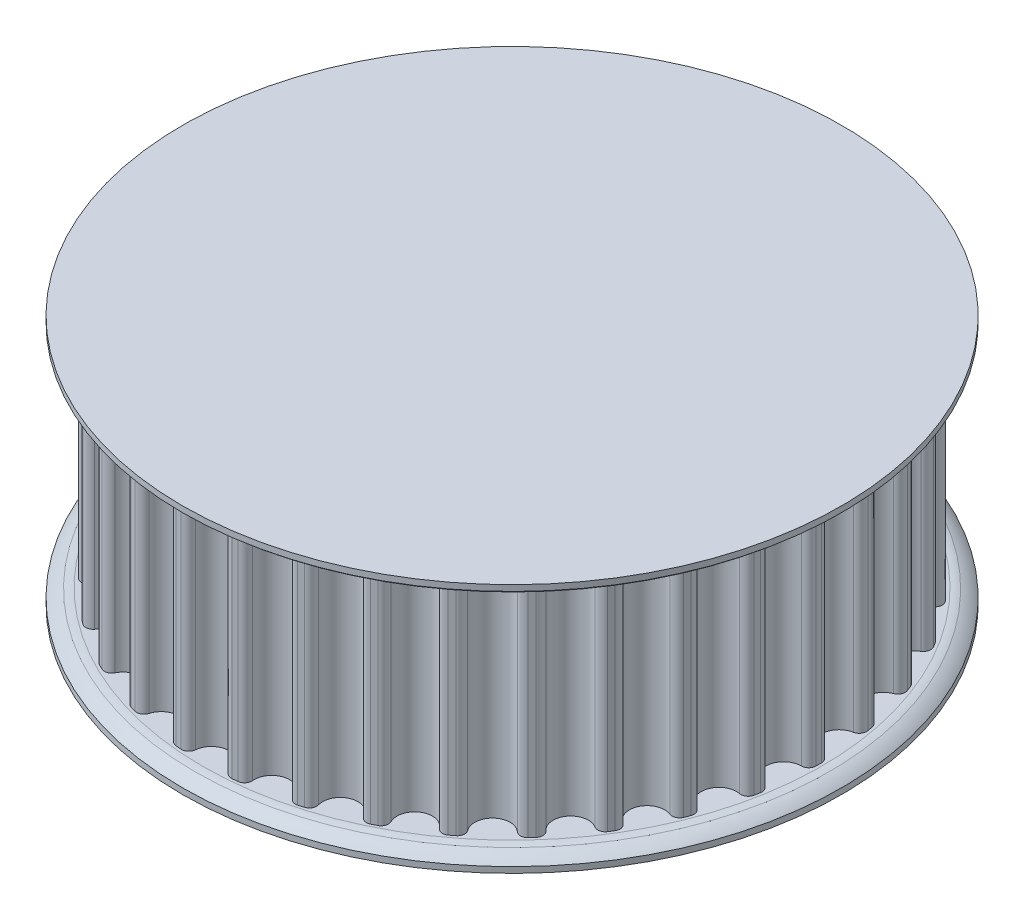
from build123d import *

# Parameters (mm, degrees)
SKETCH1_R               = 26.484839817
TOOTHOD_DEPTH           = 9.525
TOOTHPROFILE_DEPTH      = 43.021375278
TOOTHPATTERN_COUNT      = 34
LARGE_TOOTH_COUNT_DEPTH = 0.4


with BuildPart() as part:
    # Sketch1 → ToothOD (new, symmetric)
    with BuildSketch(Plane(origin=(0, 0, 0), x_dir=(1, 0, 0), z_dir=(0, 1, 0))):
        Circle(SKETCH1_R)
    extrude(amount=TOOTHOD_DEPTH, both=True)

    # Sketch2 → ToothProfile (cut, through all)
    with BuildSketch(Plane(origin=(0, 9.525, 0), x_dir=(1, 0, 0), z_dir=(0, 1, 0))):
        with BuildLine():
            ThreePointArc((-1.519107163, 25.8159054), (0, 24.424839817), (1.519107163, 25.8159054))
            ThreePointArc((1.519107163, 25.8159054), (1.742690761, 26.245908095), (2.204508681, 26.392932418))
            ThreePointArc((2.204508681, 26.392932418), (0, 26.484839817), (-2.204508681, 26.392932418))
            ThreePointArc((-2.204508681, 26.392932418), (-1.742690761, 26.245908095), (-1.519107163, 25.8159054))
        make_face()
    toothprofile = extrude(amount=-TOOTHPROFILE_DEPTH, mode=Mode.SUBTRACT)

    # ToothPattern: ToothProfile ×34 about axis
    toothpattern_axis = Axis((0, 9.525, 0), (0, -1, 0))
    for i in range(1, TOOTHPATTERN_COUNT):
        add(toothprofile.rotate(toothpattern_axis, i * 360 / TOOTHPATTERN_COUNT), mode=Mode.SUBTRACT)

    # Sketch4 → Flange (revolve)
    with BuildSketch(Plane.XY):
        with BuildLine():
            Line((0, -9.525), (26.738839817, -9.525))
            ThreePointArc((26.738839817, -9.525), (27.064595807, -9.550622571), (27.384412145, -9.617637424))
            ThreePointArc((27.384412145, -9.617637424), (27.952140722, -9.899197125), (28.453339817, -10.287))
            Line((28.453339817, -10.287), (28.453339817, -10.795))
            Line((28.453339817, -10.795), (0, -10.795))
            Line((0, -10.795), (0, -9.525))
        make_face()
        with BuildLine():
            Line((28.453339817, 10.795), (28.453339817, 10.287))
            ThreePointArc((28.453339817, 10.287), (27.952140722, 9.899197125), (27.384412145, 9.617637424))
            ThreePointArc((27.384412145, 9.617637424), (27.064595807, 9.550622571), (26.738839817, 9.525))
            Line((26.738839817, 9.525), (0, 9.525))
            Line((0, 9.525), (0, 10.795))
            Line((0, 10.795), (28.453339817, 10.795))
        make_face()
    revolve(axis=Axis((0, 12.09802, 0), (0, -1, 0)))

    # Sketch9 → Large Tooth Count (cut)
    # profile 1 of 2: a face of its own
    with BuildSketch(Plane(origin=(0, -10.795, 0), x_dir=(1, 0, 0), z_dir=(0, 1, 0))):
        with BuildLine():
            add(Edge.make_bspline(
                [(-2.989174355, 21.422297126), (-2.937372338, 21.431036898), (-2.836884144, 21.447990755), (-2.695079725, 21.495551039), (-2.568839312, 21.561735922), (-2.475077085, 21.629093694), (-2.410898341, 21.691418062), (-2.37068168, 21.74166973), (-2.337184735, 21.794442084), (-2.311650786, 21.850576253), (-2.295032481, 21.909964159), (-2.284910755, 21.971962869), (-2.283268817, 22.036807513), (-2.287710531, 22.080444809), (-2.289979824, 22.102739313)],
                knots=[0, 0, 0, 0, 1.729524362, 3.355019587, 4.903849319, 6.41264726, 7.141005846, 7.845728411, 8.528887919, 9.196229096, 9.869956459, 10.555365984, 11.261929537, 12, 12, 12, 12], degree=3))
            add(Edge.make_bspline(
                [(-2.289979824, 22.102739313), (-2.296734057, 22.135991764), (-2.310062135, 22.201608588), (-2.358350173, 22.292233629), (-2.42809507, 22.371735092), (-2.517774062, 22.440093399), (-2.624849435, 22.494177587), (-2.748288868, 22.52558726), (-2.885080706, 22.537746509), (-2.979696266, 22.527705131), (-3.029357949, 22.522434626)],
                knots=[0, 0, 0, 0, 0.857195332, 1.69149742, 2.56959501, 3.522717451, 4.535906977, 5.591035759, 6.735586199, 8, 8, 8, 8], degree=3))
            add(Edge.make_bspline(
                [(-3.029357949, 22.522434626), (-3.060397966, 22.51784344), (-3.119300841, 22.509131006), (-3.202061719, 22.489469195), (-3.27463794, 22.465469616), (-3.337923807, 22.437933612), (-3.392445424, 22.406011145), (-3.440184301, 22.371152265), (-3.4817063, 22.332592058), (-3.517326455, 22.289404099), (-3.549176296, 22.240204344), (-3.580466656, 22.183940922), (-3.610507558, 22.118312972), (-3.649628121, 22.021446908), (-3.695100521, 21.899319393), (-3.730956812, 21.80211419), (-3.748197793, 21.75537447)],
                knots=[0, 0, 0, 0, 1.15701711, 2.195605557, 3.133047247, 3.973602682, 4.736259503, 5.458737205, 6.150093777, 6.820649565, 7.517995778, 8.309278116, 9.193447536, 10.178237295, 12.16236053, 14, 14, 14, 14], degree=3))
            add(Edge.make_bspline(
                [(-3.748197793, 21.75537447), (-3.755206069, 21.744024378), (-3.770538374, 21.719193301), (-3.805735367, 21.686538361), (-3.852154196, 21.655474027), (-3.928992268, 21.615510776), (-4.038920322, 21.572206557), (-4.13352996, 21.555766592), (-4.182180605, 21.547312751)],
                knots=[0, 0, 0, 0, 0.483691287, 1.058191976, 1.728197171, 2.51319426, 4.206997195, 6, 6, 6, 6], degree=3))
            add(Edge.make_bspline(
                [(-4.182180605, 21.547312751), (-4.210162503, 21.544732885), (-4.266018725, 21.539583073), (-4.3501373, 21.551484302), (-4.432416225, 21.576858579), (-4.510866733, 21.615653104), (-4.582569522, 21.666895651), (-4.636670609, 21.735524068), (-4.677201812, 21.814904446), (-4.688178486, 21.873971753), (-4.693851699, 21.904500251)],
                knots=[0, 0, 0, 0, 0.969039054, 1.934352708, 2.91448301, 3.936533358, 4.951560652, 5.932285448, 6.931317116, 8, 8, 8, 8], degree=3))
            add(Edge.make_bspline(
                [(-4.693851699, 21.904500251), (-4.695987549, 21.934266309), (-4.700357634, 21.99516956), (-4.688750471, 22.089402279), (-4.66098975, 22.186033585), (-4.619595318, 22.2856395), (-4.563377151, 22.386074075), (-4.491665408, 22.485719437), (-4.406452836, 22.584495662), (-4.308399263, 22.683311923), (-4.194612543, 22.777430517), (-4.066983859, 22.867491229), (-3.922682053, 22.947724341), (-3.766183459, 23.024105), (-3.59569268, 23.090671898), (-3.413369985, 23.146791523), (-3.219935353, 23.191623402), (-3.086665382, 23.212080504), (-3.018642324, 23.222522126)],
                knots=[0, 0, 0, 0, 0.616992876, 1.262406708, 1.953436793, 2.694186468, 3.491785785, 4.331720199, 5.232443181, 6.191491911, 7.211328802, 8.287098999, 9.421877506, 10.6268312, 11.891873317, 13.20814025, 14.574991515, 16, 16, 16, 16], degree=3))
            add(Edge.make_bspline(
                [(-3.018642324, 23.222522126), (-2.956502574, 23.229868403), (-2.834279655, 23.244317823), (-2.652885578, 23.251968677), (-2.477176266, 23.24879706), (-2.307752159, 23.233447531), (-2.14520404, 23.208240214), (-1.991428111, 23.170687628), (-1.846751613, 23.122484059), (-1.712402451, 23.063667397), (-1.588772518, 22.996636653), (-1.47954172, 22.919415754), (-1.383583108, 22.835296255), (-1.30291333, 22.742833554), (-1.236548042, 22.644277623), (-1.184348845, 22.541222862), (-1.146429345, 22.433417051), (-1.133726374, 22.358974532), (-1.127334512, 22.321516657)],
                knots=[0, 0, 0, 0, 1.29520736, 2.547548443, 3.755770276, 4.931439763, 6.067276722, 7.158478602, 8.205065335, 9.220708341, 10.191667751, 11.111604101, 11.984767475, 12.827763398, 13.644835172, 14.438633702, 15.214354063, 16, 16, 16, 16], degree=3))
            add(Edge.make_bspline(
                [(-1.127334512, 22.321516657), (-1.122744346, 22.272435956), (-1.113774714, 22.176527483), (-1.127870267, 22.03389528), (-1.16467137, 21.897883678), (-1.226012654, 21.769600919), (-1.306072729, 21.648404502), (-1.399100261, 21.530503176), (-1.508556613, 21.418484077), (-1.590718872, 21.350709007), (-1.632754824, 21.316033845)],
                knots=[0, 0, 0, 0, 0.999307942, 1.95274509, 2.89280684, 3.847469781, 4.826736893, 5.837896762, 6.893822171, 8, 8, 8, 8], degree=3))
            add(Edge.make_bspline(
                [(-1.632754824, 21.316033845), (-1.588495581, 21.305776879), (-1.500106602, 21.285292959), (-1.371373523, 21.241045153), (-1.246851476, 21.186093735), (-1.127204628, 21.122575113), (-1.015789324, 21.050944801), (-0.914738081, 20.973915986), (-0.828952392, 20.888993154), (-0.754509894, 20.800590918), (-0.694588383, 20.705976047), (-0.64645357, 20.607091201), (-0.612045096, 20.502763641), (-0.599596337, 20.430707686), (-0.593339199, 20.394490095)],
                knots=[0, 0, 0, 0, 1.105432154, 2.207629679, 3.307562078, 4.416219424, 5.501615637, 6.529263528, 7.502836638, 8.434323304, 9.336866095, 10.221635641, 11.106138095, 12, 12, 12, 12], degree=3))
            add(Edge.make_bspline(
                [(-0.593339199, 20.394490095), (-0.58913004, 20.350475692), (-0.580655097, 20.261854783), (-0.590555296, 20.126488756), (-0.618940835, 19.990294588), (-0.663826288, 19.853299674), (-0.72589578, 19.716984198), (-0.809928785, 19.585435481), (-0.909979718, 19.456224357), (-1.028972469, 19.33290529), (-1.163504927, 19.216026225), (-1.313676193, 19.10880806), (-1.477343636, 19.010667276), (-1.654442451, 18.922087146), (-1.844557893, 18.845325881), (-2.047486683, 18.782353261), (-2.262163587, 18.730616549), (-2.410619, 18.708335234), (-2.486432949, 18.696956501)],
                knots=[0, 0, 0, 0, 0.755502188, 1.521167776, 2.311260098, 3.131064477, 3.983369295, 4.866598224, 5.795728405, 6.775544234, 7.793686616, 8.841052966, 9.928517098, 11.055987385, 12.225912003, 13.432425352, 14.688778208, 16, 16, 16, 16], degree=3))
            add(Edge.make_bspline(
                [(-2.486432949, 18.696956501), (-2.56104994, 18.688238666), (-2.706382223, 18.671258849), (-2.921164169, 18.667660139), (-3.12602666, 18.678642049), (-3.319641558, 18.710907404), (-3.500952639, 18.755481016), (-3.668925584, 18.810348508), (-3.822748915, 18.875861841), (-3.962311107, 18.950257209), (-4.085991658, 19.034313409), (-4.197765253, 19.120283068), (-4.294467467, 19.211969671), (-4.377477293, 19.305496355), (-4.443486565, 19.399486652), (-4.495373395, 19.488119475), (-4.532162248, 19.571295544), (-4.543766221, 19.626586193), (-4.549190762, 19.652433063)],
                knots=[0, 0, 0, 0, 1.463140174, 2.849773209, 4.180577489, 5.455562625, 6.66826453, 7.816537585, 8.895033028, 9.922760858, 10.892857179, 11.806051256, 12.667739389, 13.485698176, 14.238898136, 14.901532387, 15.486496335, 16, 16, 16, 16], degree=3))
            add(Edge.make_bspline(
                [(-4.549190762, 19.652433063), (-4.551595094, 19.684017971), (-4.55626721, 19.745393992), (-4.537820399, 19.835781696), (-4.496487597, 19.917604321), (-4.43616361, 19.990764839), (-4.359376149, 20.052081226), (-4.271225528, 20.102212879), (-4.172105497, 20.138181202), (-4.101473201, 20.150588791), (-4.065201699, 20.156960407)],
                knots=[0, 0, 0, 0, 0.970380248, 1.885649893, 2.794170111, 3.763168665, 4.777883816, 5.798277237, 6.869358696, 8, 8, 8, 8], degree=3))
            add(Edge.make_bspline(
                [(-4.065201699, 20.156960407), (-4.042009169, 20.159314472), (-3.995675326, 20.164017403), (-3.925500889, 20.160857685), (-3.855430802, 20.150130114), (-3.787598761, 20.131700204), (-3.726105724, 20.108332843), (-3.6744391, 20.083253306), (-3.635055849, 20.054699418), (-3.61711741, 20.031749221), (-3.608894668, 20.021229157)],
                knots=[0, 0, 0, 0, 1.130934302, 2.259371139, 3.400240633, 4.567996139, 5.66611556, 6.590650481, 7.353972957, 8, 8, 8, 8], degree=3))
            add(Edge.make_bspline(
                [(-3.608894668, 20.021229157), (-3.58826172, 19.990133484), (-3.548170814, 19.929712951), (-3.486427345, 19.844007189), (-3.426096111, 19.765323717), (-3.36602379, 19.694550872), (-3.307388164, 19.631329293), (-3.250007228, 19.575052225), (-3.192850786, 19.527315143), (-3.137043005, 19.484850032), (-3.078964489, 19.450330803), (-3.017675524, 19.422869202), (-2.953135944, 19.399732247), (-2.883965544, 19.38544195), (-2.81148876, 19.375134614), (-2.735305894, 19.372261853), (-2.655242146, 19.373301568), (-2.600990643, 19.38013185), (-2.573050918, 19.38364947)],
                knots=[0, 0, 0, 0, 1.373851757, 2.669466394, 3.888227543, 5.023417982, 6.085757841, 7.062273281, 7.979950218, 8.825992354, 9.641679739, 10.460673234, 11.295929133, 12.160089257, 13.055912031, 13.988453464, 14.964046067, 16, 16, 16, 16], degree=3))
            add(Edge.make_bspline(
                [(-2.573050918, 19.38364947), (-2.53685402, 19.389369808), (-2.465079372, 19.400712637), (-2.360696968, 19.432352716), (-2.259752353, 19.472145735), (-2.163229883, 19.522141373), (-2.073601604, 19.581203848), (-1.993081306, 19.649492614), (-1.923754493, 19.727044454), (-1.865708665, 19.812453912), (-1.820962013, 19.90401544), (-1.791186463, 20.000265721), (-1.780417908, 20.100920515), (-1.786126096, 20.168293859), (-1.789024355, 20.202501813)],
                knots=[0, 0, 0, 0, 1.047577964, 2.077237141, 3.113288941, 4.149550817, 5.181954536, 6.178854065, 7.162122893, 8.149662342, 9.124929152, 10.068085946, 11.019095334, 12, 12, 12, 12], degree=3))
            add(Edge.make_bspline(
                [(-1.789024355, 20.202501813), (-1.79338015, 20.227879886), (-1.801865788, 20.277319584), (-1.821125584, 20.348624382), (-1.848702153, 20.413966611), (-1.880310178, 20.475485737), (-1.920102001, 20.531012095), (-1.965868927, 20.581130088), (-2.017558991, 20.626522993), (-2.075334461, 20.666450966), (-2.13917355, 20.700526113), (-2.208122106, 20.728052655), (-2.281698076, 20.749505511), (-2.360297746, 20.764666605), (-2.443941371, 20.773698557), (-2.532590166, 20.774592655), (-2.626023854, 20.77179409), (-2.689478026, 20.76382228), (-2.722176699, 20.759714313)],
                knots=[0, 0, 0, 0, 1.005062426, 1.957988816, 2.875100814, 3.769176044, 4.652616187, 5.532764041, 6.413831912, 7.332488552, 8.268256574, 9.2328023, 10.225631724, 11.255707614, 12.354168988, 13.504802474, 14.71419571, 16, 16, 16, 16], degree=3))
            add(Edge.make_bspline(
                [(-2.722176699, 20.759714313), (-2.735282711, 20.757684936), (-2.765122522, 20.753064444), (-2.815376345, 20.743818987), (-2.876810616, 20.732490594), (-2.944898332, 20.718109291), (-3.011517625, 20.702642047), (-3.069428782, 20.693424949), (-3.113353478, 20.683021772), (-3.138571386, 20.67979187), (-3.149015762, 20.678454157)],
                knots=[0, 0, 0, 0, 0.732348479, 1.667413444, 2.821560075, 4.182010793, 5.510304512, 6.596801561, 7.418844255, 8, 8, 8, 8], degree=3))
            add(Edge.make_bspline(
                [(-3.149015762, 20.678454157), (-3.184389644, 20.674481548), (-3.251789063, 20.66691236), (-3.349204943, 20.671615454), (-3.437238671, 20.687807304), (-3.514722823, 20.718089674), (-3.580560286, 20.760540902), (-3.630622475, 20.817530914), (-3.665642045, 20.886065094), (-3.675334552, 20.937031879), (-3.680332168, 20.963311188)],
                knots=[0, 0, 0, 0, 1.256331823, 2.393744462, 3.433608723, 4.406497552, 5.31685571, 6.173923708, 7.058445142, 8, 8, 8, 8], degree=3))
            add(Edge.make_bspline(
                [(-3.680332168, 20.963311188), (-3.682064753, 20.990160052), (-3.685445415, 21.04254819), (-3.665957793, 21.12000392), (-3.622985305, 21.188692012), (-3.561971248, 21.251032878), (-3.481312609, 21.304028634), (-3.383484926, 21.347434423), (-3.268790557, 21.381436488), (-3.185834808, 21.394719467), (-3.141872012, 21.401758845)],
                knots=[0, 0, 0, 0, 0.830293979, 1.620089307, 2.426940212, 3.314164534, 4.304329739, 5.398367825, 6.62125257, 8, 8, 8, 8], degree=3))
            Line((-3.141872012, 21.401758845), (-2.989174355, 21.422297126))
        make_face()
    # profile 2 of 2: a face of its own
    with BuildSketch(Plane(origin=(0, -10.795, 0), x_dir=(1, 0, 0), z_dir=(0, 1, 0))):
        with BuildLine():
            Line((3.094394652, 19.095097057), (3.164046214, 19.572835338))
            Line((3.164046214, 19.572835338), (1.358463402, 19.833582213))
            add(Edge.make_bspline(
                [(1.358463402, 19.833582213), (1.328334435, 19.838295682), (1.269871964, 19.847441732), (1.185861032, 19.866453288), (1.107642614, 19.888081862), (1.036484776, 19.915923083), (0.969776894, 19.943155715), (0.910559882, 19.977146394), (0.856700505, 20.01304683), (0.810188374, 20.05376845), (0.769264599, 20.096749148), (0.735811699, 20.142924788), (0.70800153, 20.191236584), (0.68788081, 20.242164099), (0.67286557, 20.295656233), (0.666404237, 20.351599602), (0.665171564, 20.409988455), (0.669524123, 20.449159961), (0.671770433, 20.469375963)],
                knots=[0, 0, 0, 0, 1.386523694, 2.690420825, 3.915848069, 5.072495457, 6.163926318, 7.188226611, 8.172005809, 9.102951206, 9.993655086, 10.865539522, 11.689996443, 12.522086876, 13.349649942, 14.209363276, 15.07587119, 16, 16, 16, 16], degree=3))
            add(Edge.make_bspline(
                [(0.671770433, 20.469375963), (0.676396782, 20.492039732), (0.685702886, 20.537628895), (0.719406901, 20.601744183), (0.765923881, 20.662810097), (0.824515153, 20.721079861), (0.889482985, 20.775639946), (0.953713236, 20.829710368), (1.020082486, 20.877335878), (1.068468639, 20.900735289), (1.092358714, 20.912288463)],
                knots=[0, 0, 0, 0, 0.876865495, 1.763853345, 2.727202122, 3.793094957, 4.901927515, 5.956918887, 6.991253494, 8, 8, 8, 8], degree=3))
            Line((1.092358714, 20.912288463), (3.38103762, 22.742874401))
            add(Edge.make_bspline(
                [(3.38103762, 22.742874401), (3.417462838, 22.771396575), (3.486283292, 22.825285311), (3.585796747, 22.897325763), (3.674313305, 22.956717108), (3.75396559, 23.004905525), (3.832273315, 23.040183491), (3.914868443, 23.059546969), (4.002660465, 23.066183462), (4.062110735, 23.059664411), (4.092733714, 23.056306432)],
                knots=[0, 0, 0, 0, 1.380928754, 2.609075503, 3.66628817, 4.562348433, 5.386058581, 6.217923294, 7.082047949, 8, 8, 8, 8], degree=3))
            add(Edge.make_bspline(
                [(4.092733714, 23.056306432), (4.119884074, 23.051880015), (4.172407673, 23.04331691), (4.247594237, 23.025413979), (4.316805166, 23.003925797), (4.380288839, 22.97924992), (4.437858411, 22.950370155), (4.490162937, 22.918570607), (4.535878896, 22.881734963), (4.575494262, 22.841077348), (4.609857568, 22.797337169), (4.637538342, 22.749338915), (4.660167772, 22.698281052), (4.676402611, 22.643055724), (4.685654801, 22.584236444), (4.690423394, 22.521794765), (4.688313881, 22.455731627), (4.683026726, 22.410657689), (4.680307152, 22.387472838)],
                knots=[0, 0, 0, 0, 1.294866154, 2.504977098, 3.635282723, 4.70487979, 5.707663382, 6.664340082, 7.581395477, 8.463407814, 9.332409083, 10.19289331, 11.065165541, 11.956481128, 12.894185165, 13.863709213, 14.901148088, 16, 16, 16, 16], degree=3))
            Line((4.680307152, 22.387472838), (4.357052464, 20.158622838))
            Line((4.357052464, 20.158622838), (4.40259387, 20.152372057))
            add(Edge.make_bspline(
                [(4.40259387, 20.152372057), (4.452441082, 20.144484107), (4.548364968, 20.129304865), (4.684659715, 20.095448364), (4.807493263, 20.053083742), (4.901377226, 20.012861715), (4.967047382, 19.974801486), (5.00835284, 19.943154011), (5.042130953, 19.90727109), (5.066969611, 19.866512093), (5.085497459, 19.822649126), (5.096169237, 19.774918394), (5.098676242, 19.723335544), (5.094842464, 19.688298496), (5.092858714, 19.670168932)],
                knots=[0, 0, 0, 0, 1.923134743, 3.700799891, 5.344126703, 6.872847122, 7.585027512, 8.231847723, 8.850073344, 9.451410127, 10.041400934, 10.65795849, 11.305574297, 12, 12, 12, 12], degree=3))
            add(Edge.make_bspline(
                [(5.092858714, 19.670168932), (5.086773899, 19.641893215), (5.074884797, 19.586645375), (5.028397012, 19.513604309), (4.960236475, 19.4572737), (4.872899768, 19.416467319), (4.76803682, 19.390676789), (4.646674375, 19.379158186), (4.5092637, 19.381293305), (4.413226427, 19.393264885), (4.362410277, 19.399599401)],
                knots=[0, 0, 0, 0, 0.796006402, 1.555314555, 2.344806743, 3.214876809, 4.202539992, 5.321330418, 6.582637031, 8, 8, 8, 8], degree=3))
            Line((4.362410277, 19.399599401), (4.249896214, 19.415672838))
            Line((4.249896214, 19.415672838), (4.180244652, 18.937934557))
            add(Edge.make_bspline(
                [(4.180244652, 18.937934557), (4.173486165, 18.9017501), (4.160495069, 18.832196694), (4.115915202, 18.737953251), (4.055169943, 18.657808785), (3.975922889, 18.595035436), (3.883049275, 18.549162718), (3.777309504, 18.522604373), (3.660379054, 18.513600767), (3.579520771, 18.522515056), (3.537307152, 18.527168932)],
                knots=[0, 0, 0, 0, 1.021620082, 1.963748057, 2.874151651, 3.799940907, 4.752841797, 5.738191868, 6.819179648, 8, 8, 8, 8], degree=3))
            add(Edge.make_bspline(
                [(3.537307152, 18.527168932), (3.50122042, 18.533567737), (3.43151418, 18.545927866), (3.335998406, 18.585776234), (3.25145631, 18.636761889), (3.181150437, 18.703274917), (3.127008518, 18.783737984), (3.094850707, 18.878066859), (3.082095814, 18.983703222), (3.090158864, 19.056732404), (3.094394652, 19.095097057)],
                knots=[0, 0, 0, 0, 1.074675352, 2.07587592, 3.023133951, 3.964184908, 4.898782682, 5.845514896, 6.868177473, 8, 8, 8, 8], degree=3))
        make_face()
        Polygon((1.846917308, 20.52206112), (3.271202464, 20.315785338), (3.503374339, 21.915985338), align=None, mode=Mode.SUBTRACT)
    large_tooth_count = extrude(amount=LARGE_TOOTH_COUNT_DEPTH, mode=Mode.SUBTRACT)

    # Mirror1: Large Tooth Count across plane
    add(large_tooth_count.mirror(Plane.XY), mode=Mode.SUBTRACT)


solid = part.part
